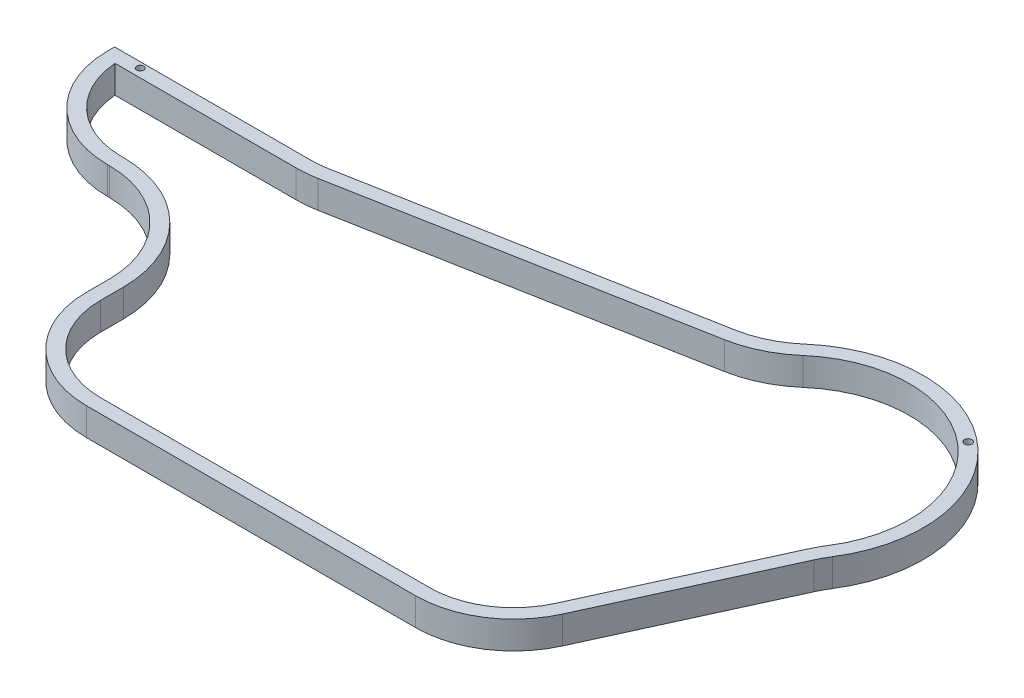
from build123d import *

# Parameters (mm, degrees)
BOSS_EXTRUDE1_DEPTH = 5
CUT_EXTRUDE2_DEPTH  = 8.048
SKETCH3_R           = 0.640852302
SKETCH3_R_2         = 0.683244838
CUT_EXTRUDE3_DEPTH  = 8.048


with BuildPart() as part:
    # Sketch1 → Boss-Extrude1 (new body)
    with BuildSketch(Plane(origin=(0, 0, 0), x_dir=(1, 0, 0), z_dir=(0, 1, 0))):
        with BuildLine():
            Line((-0.55984013, 25.079292929), (-35.890546419, 25.079292929))
            Line((-35.890546419, 25.079292929), (-35.890546419, 23.777222222))
            ThreePointArc((-35.890546419, 23.777222222), (-30.682904989, 11.204863653), (-18.110546419, 5.997222222))
            Line((-18.110546419, 5.997222222), (-17.78, 5.997222222))
            ThreePointArc((-17.78, 5.997222222), (-5.207641431, 0.789580792), (0, -11.782777778))
            Line((0, -11.782777778), (0, -15.913484848))
            ThreePointArc((0, -15.913484848), (5.207641431, -28.485843418), (17.78, -33.693484848))
            Line((17.78, -33.693484848), (77.312672268, -33.693484848))
            ThreePointArc((77.312672268, -33.693484848), (86.927320297, -30.869652248), (93.487957466, -23.295120763))
            Line((93.487957466, -23.295120763), (107.768626914, 7.997929157))
            ThreePointArc((107.768626914, 7.997929157), (108.308432376, 9.081526458), (108.920724009, 10.125878891))
            ThreePointArc((108.920724009, 10.125878891), (104.307418831, 41.01014517), (73.08061258, 40.926123744))
            ThreePointArc((73.08061258, 40.926123744), (69.142100225, 38.332807414), (64.660382122, 36.866051805))
            Line((64.660382122, 36.866051805), (2.680771994, 25.377106766))
            ThreePointArc((2.680771994, 25.377106766), (1.067293855, 25.153902931), (-0.55984013, 25.079292929))
        make_face()
    extrude(amount=BOSS_EXTRUDE1_DEPTH)

    # Sketch2 → Cut-Extrude2 (cut)
    with BuildSketch(Plane(origin=(0, 5, 0), x_dir=(1, 0, 0), z_dir=(0, 1, 0))):
        with BuildLine():
            Line((-18.110546419, 8.537222222), (-17.78, 8.537222222))
            ThreePointArc((-17.78, 8.537222222), (-3.411590206, 2.585632016), (2.54, -11.782777778))
            Line((2.54, -11.782777778), (2.54, -15.913484848))
            ThreePointArc((2.54, -15.913484848), (7.003692655, -26.689792194), (17.78, -31.153484848))
            Line((17.78, -31.153484848), (77.312672268, -31.153484848))
            ThreePointArc((77.312672268, -31.153484848), (85.55379915, -28.733056905), (91.177202437, -22.240601346))
            Line((91.177202437, -22.240601346), (105.457871886, 9.052448573))
            ThreePointArc((105.457871886, 9.052448573), (106.074792413, 10.290845489), (106.77455428, 11.484391127))
            ThreePointArc((106.77455428, 11.484391127), (102.651926694, 39.083763644), (74.746447235, 39.008678854))
            ThreePointArc((74.746447235, 39.008678854), (70.245290257, 36.044888763), (65.123326712, 34.368596639))
            Line((65.123326712, 34.368596639), (3.143716583, 22.879651599))
            ThreePointArc((3.143716583, 22.879651599), (1.299741567, 22.624561503), (-0.55984013, 22.539292929))
            Line((-0.55984013, 22.539292929), (-33.300185357, 22.539292929))
            ThreePointArc((-33.300185357, 22.539292929), (-28.439911298, 12.571785095), (-18.110546419, 8.537222222))
        make_face()
    extrude(amount=-CUT_EXTRUDE2_DEPTH, mode=Mode.SUBTRACT)

    # Sketch3 → Cut-Extrude3 (cut)
    with BuildSketch(Plane(origin=(0, 5, 0), x_dir=(1, 0, 0), z_dir=(0, 1, 0))):
        with Locations(Location((-30.261155499, 24.077194613, 0), (0, 0, 270))):
            Circle(SKETCH3_R)
        with Locations(Location((103.209357625, 40.426722425, 0), (0, 0, 270))):
            Circle(SKETCH3_R_2)
    extrude(amount=-CUT_EXTRUDE3_DEPTH, mode=Mode.SUBTRACT)


solid = part.part
